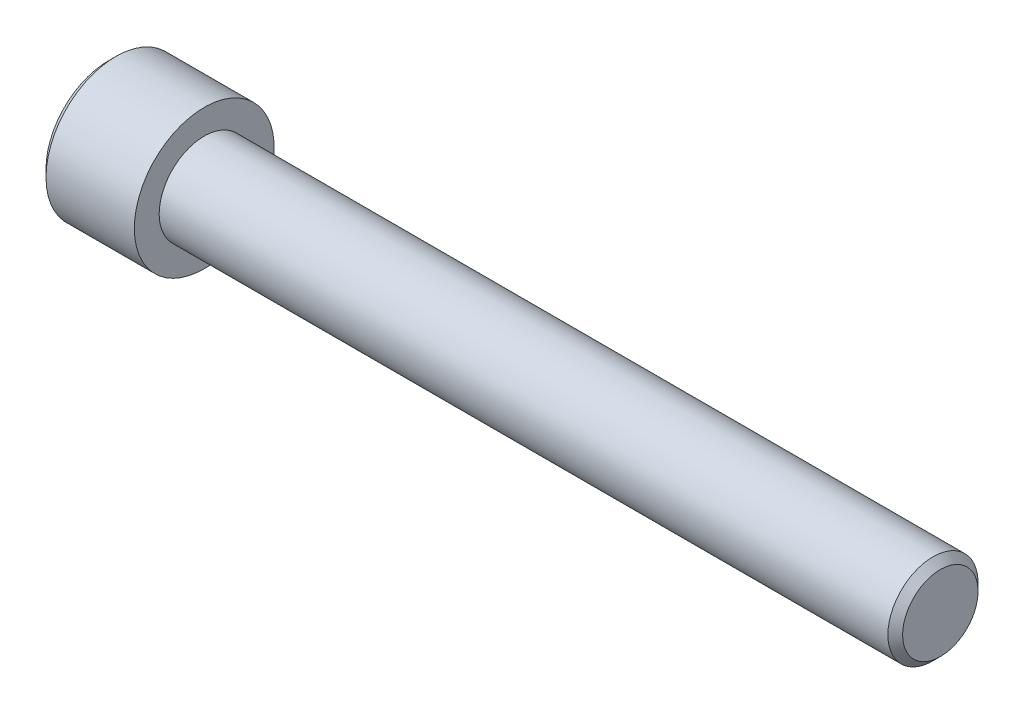
from build123d import *

# Parameters (mm, degrees)
EXTRUDE1_DEPTH = 3.81


with BuildPart() as part:
    # Sketch1 → Revolve1 (revolve)
    with BuildSketch(Plane.XY, mode=Mode.PRIVATE) as revolve1_sk:
        Polygon((28.702, 0), (28.702, 2.6035), (28.194, 3.1115), (-22.098, 3.1115), (-22.098, 4.826), (-28.194, 4.826), (-28.702, 4.318), (-28.702, 0), align=None)
    revolve(revolve1_sk.sketch.rotate(Axis((-40.759022879, 0, 0), (1, 0, 0)), 90), axis=Axis((-40.759022879, 0, 0), (1, 0, 0)))

    # Sketch2 → Extrude1 (cut)
    with BuildSketch(Plane.ZY.offset(28.702)):
        Polygon((0, 2.749630657), (-2.38125, 1.374815329), (-2.38125, -1.374815329), (0, -2.749630657), (2.38125, -1.374815329), (2.38125, 1.374815329), align=None)
    extrude(amount=-EXTRUDE1_DEPTH, mode=Mode.SUBTRACT)


solid = part.part
